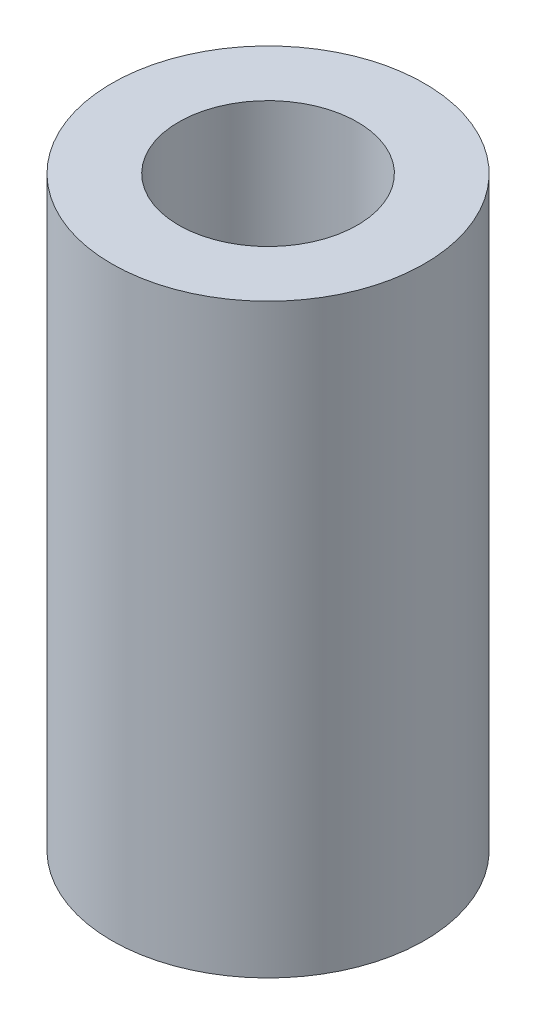
from build123d import *

# Parameters (mm, degrees)
SKETCH2_R           = 5.335
SKETCH2_R_2         = 3.05
BOSS_EXTRUDE1_DEPTH = 20


with BuildPart() as part:
    # Sketch2 → Boss-Extrude1 (new body)
    with BuildSketch(Plane(origin=(0, 0, 0), x_dir=(1, 0, 0), z_dir=(0, 1, 0))):
        with Locations(Location((0, 0, 0), (0, 0, 270))):
            Circle(SKETCH2_R)
        with Locations(Location((0, 0, 0), (0, 0, 270))):
            Circle(SKETCH2_R_2, mode=Mode.SUBTRACT)
    extrude(amount=BOSS_EXTRUDE1_DEPTH)


solid = part.part
